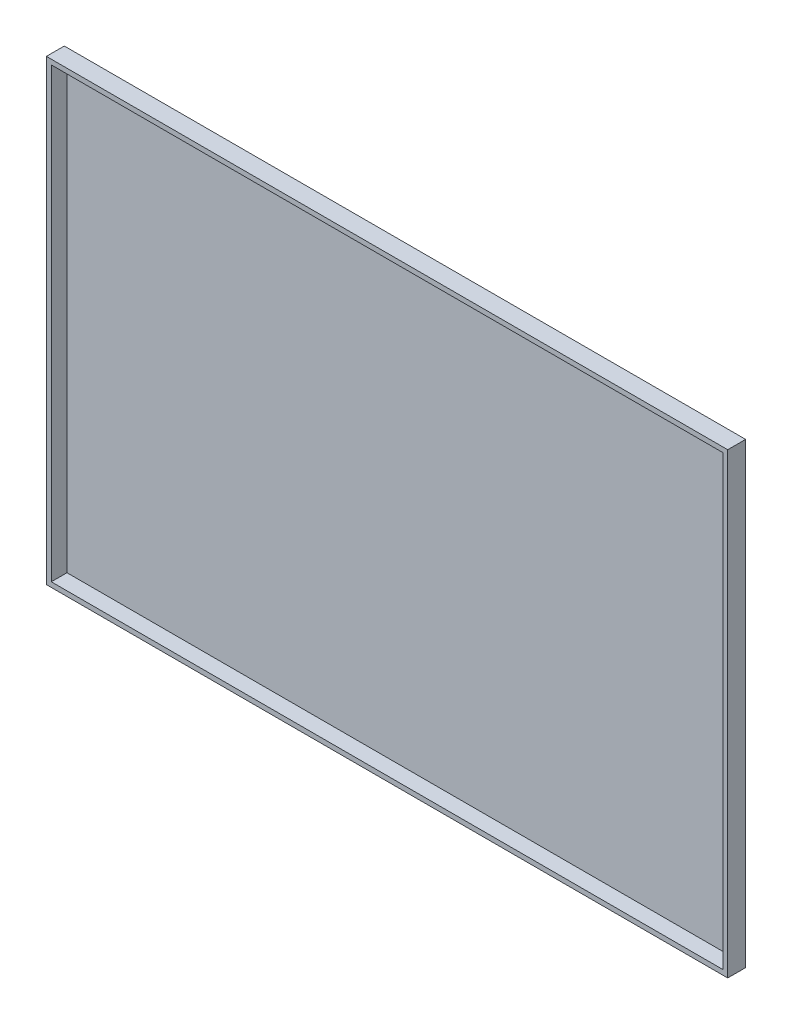
from build123d import *

# Parameters (mm, degrees)
SKETCH1_W           = 3044
SKETCH1_H           = 2044
BOSS_EXTRUDE1_DEPTH = 10
SKETCH1_3_W         = 3044
SKETCH1_3_H         = 2044
SKETCH1_3_W_2       = 3000
SKETCH1_3_H_2       = 2000
BOSS_EXTRUDE2_DEPTH = 80


with BuildPart() as part:
    # Sketch1 → Boss-Extrude1 (new body)
    with BuildSketch(Plane.XY):
        Rectangle(SKETCH1_W, SKETCH1_H)
    extrude(amount=BOSS_EXTRUDE1_DEPTH)

    # Sketch1<3> → Boss-Extrude2 (add)
    with BuildSketch(Plane.XY):
        Rectangle(SKETCH1_3_W, SKETCH1_3_H)
        Rectangle(SKETCH1_3_W_2, SKETCH1_3_H_2, mode=Mode.SUBTRACT)
    extrude(amount=BOSS_EXTRUDE2_DEPTH)


solid = part.part
